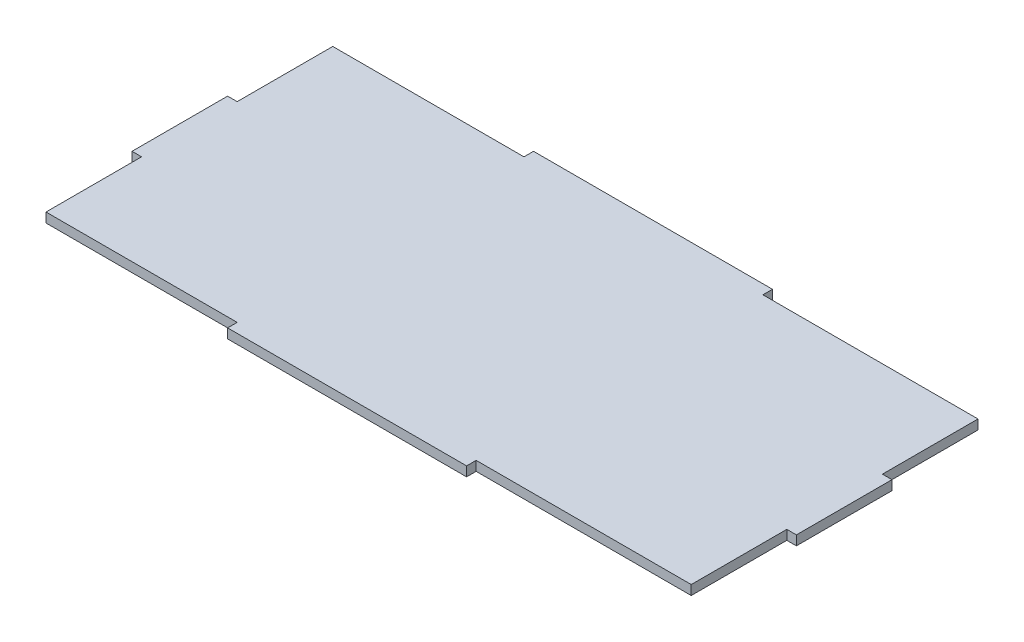
from build123d import *

# Parameters (mm, degrees)
SKETCH_2_W      = 2
SKETCH_2_H      = 20
SKETCH_2_W_2    = 50
SKETCH_2_H_2    = 2
SKETCH_2_W_3    = 135
SKETCH_2_H_3    = 60
EXTRUDE_1_DEPTH = 2


with BuildPart() as part:
    # 草图2 → 凸台-拉伸1 (new body)
    with BuildSketch(Plane(origin=(0, 0, 0), x_dir=(1, 0, 0), z_dir=(0, 1, 0))):
        with Locations((-1, 0)):
            Rectangle(SKETCH_2_W, SKETCH_2_H)
        with Locations((65, 31)):
            Rectangle(SKETCH_2_W_2, SKETCH_2_H_2)
        with Locations((136, 0)):
            Rectangle(SKETCH_2_W, SKETCH_2_H)
        with Locations((65, -31)):
            Rectangle(SKETCH_2_W_2, SKETCH_2_H_2)
        with Locations((67.5, 0)):
            Rectangle(SKETCH_2_W_3, SKETCH_2_H_3)
    extrude(amount=EXTRUDE_1_DEPTH)


solid = part.part
